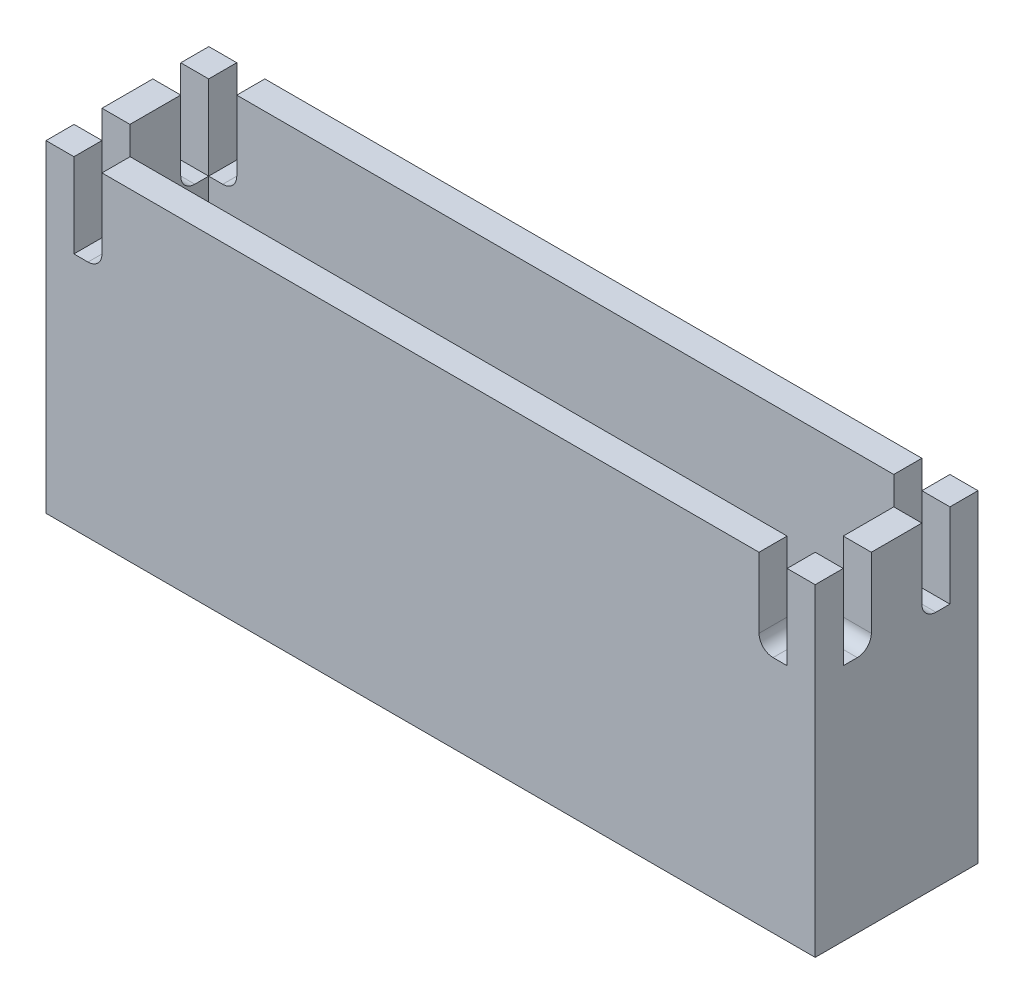
from build123d import *

# Parameters (mm, degrees)
SZKIC1_W                    = 25.4
SZKIC1_H                    = 5.8
DODANIE_WYCI_GNI_CIE2_DEPTH = 3.4
SZKIC3_W                    = 0.64
SZKIC3_H                    = 0.643583424
WYTNIJ_WYCI_GNI_CIE1_DEPTH  = 3.4
SZKIC5_W                    = 5.8
SZKIC5_H                    = 3.4
DODANIE_WYCI_GNI_CIE3_DEPTH = 1
SZKIC6_W                    = 5.8
SZKIC6_H                    = 3.4
DODANIE_WYCI_GNI_CIE4_DEPTH = 1
SZKIC7_W                    = 27.4
SZKIC7_H                    = 5.8
SZKIC7_W_2                  = 25.404799249
SZKIC7_H_2                  = 3.8
DODANIE_WYCI_GNI_CIE6_DEPTH = 8.1
SZKIC8_W                    = 1
SZKIC8_H                    = 1
SZKIC8_W_2                  = 0.995200751
SZKIC8_H_2                  = 0.995200751
WYTNIJ_WYCI_GNI_CIE3_DEPTH  = 3
ZAOKR_GLENIE1_R             = 0.5


with BuildPart() as part:
    # Szkic1 → Dodanie-wyciągnięcie2 (new body)
    with BuildSketch(Plane(origin=(0, 0, 0), x_dir=(1, 0, 0), z_dir=(0, 1, 0))):
        Rectangle(SZKIC1_W, SZKIC1_H)
    extrude(amount=DODANIE_WYCI_GNI_CIE2_DEPTH)

    # Szkic3 → Wytnij-wyciągnięcie1 (cut)
    with BuildSketch(Plane(origin=(0, 3.4, 0), x_dir=(1, 0, 0), z_dir=(0, 1, 0))):
        with Locations((-11.43, 0)):
            Rectangle(SZKIC3_W, SZKIC3_H)
        with Locations((-8.89, 0)):
            Rectangle(SZKIC3_W, SZKIC3_H)
        with Locations((-6.35, 0)):
            Rectangle(SZKIC3_W, SZKIC3_H)
        with Locations((-3.81, 0)):
            Rectangle(SZKIC3_W, SZKIC3_H)
        with Locations((-1.27, 0)):
            Rectangle(SZKIC3_W, SZKIC3_H)
        with Locations((1.27, 0)):
            Rectangle(SZKIC3_W, SZKIC3_H)
        with Locations((3.81, 0)):
            Rectangle(SZKIC3_W, SZKIC3_H)
        with Locations((6.35, 0)):
            Rectangle(SZKIC3_W, SZKIC3_H)
        with Locations((8.89, 0)):
            Rectangle(SZKIC3_W, SZKIC3_H)
        with Locations((11.43, 0)):
            Rectangle(SZKIC3_W, SZKIC3_H)
    extrude(amount=-WYTNIJ_WYCI_GNI_CIE1_DEPTH, mode=Mode.SUBTRACT)

    # Szkic5 → Dodanie-wyciągnięcie3 (add)
    with BuildSketch(Plane.ZY.offset(12.7)):
        with Locations((0, 1.7)):
            Rectangle(SZKIC5_W, SZKIC5_H)
    extrude(amount=DODANIE_WYCI_GNI_CIE3_DEPTH)

    # Szkic6 → Dodanie-wyciągnięcie4 (add)
    with BuildSketch(Plane(origin=(12.7, 0, 0), x_dir=(0, 0, -1), z_dir=(1, 0, 0))):
        with Locations((0, 1.7)):
            Rectangle(SZKIC6_W, SZKIC6_H)
    extrude(amount=DODANIE_WYCI_GNI_CIE4_DEPTH)

    # Szkic7 → Dodanie-wyciągnięcie6 (add)
    with BuildSketch(Plane(origin=(0, 3.4, 0), x_dir=(1, 0, 0), z_dir=(0, 1, 0))):
        Rectangle(SZKIC7_W, SZKIC7_H)
        with Locations((-0.002399624, 0)):
            Rectangle(SZKIC7_W_2, SZKIC7_H_2, mode=Mode.SUBTRACT)
    extrude(amount=DODANIE_WYCI_GNI_CIE6_DEPTH)

    # Szkic8 → Wytnij-wyciągnięcie3 (cut)
    with BuildSketch(Plane(origin=(0, 11.5, 0), x_dir=(1, 0, 0), z_dir=(0, 1, 0))):
        with Locations((12.2, 2.4)):
            Rectangle(SZKIC8_W, SZKIC8_H)
        with Locations((13.2, 1.4)):
            Rectangle(SZKIC8_W, SZKIC8_H)
        with Locations((13.2, -1.4)):
            Rectangle(SZKIC8_W, SZKIC8_H)
        with Locations((12.2, -2.4)):
            Rectangle(SZKIC8_W, SZKIC8_H)
        with Locations((-12.204799249, -2.4)):
            Rectangle(SZKIC8_W, SZKIC8_H)
        with Locations((-13.202399624, -1.402399625)):
            Rectangle(SZKIC8_W_2, SZKIC8_H_2)
        with Locations((-13.202399624, 1.402399625)):
            Rectangle(SZKIC8_W_2, SZKIC8_H_2)
        with Locations((-12.204799249, 2.4)):
            Rectangle(SZKIC8_W, SZKIC8_H)
    extrude(amount=-WYTNIJ_WYCI_GNI_CIE3_DEPTH, mode=Mode.SUBTRACT)

    # Zaokrąglenie1
    zaokr_glenie1_edges = [part.edges().sort_by_distance(p)[0] for p in [
        (-13.202399624, 8.5, -0.904799249),
        (-13.202399624, 8.5, 0.904799249),
        (13.2, 8.5, 0.9),
        (13.2, 8.5, -0.9),
        (11.7, 8.5, -2.4),
        (11.7, 8.5, 2.4),
        (-11.704799249, 8.5, 2.4),
        (-11.704799249, 8.5, -2.4),
    ]]
    fillet(zaokr_glenie1_edges, radius=ZAOKR_GLENIE1_R)


solid = part.part
